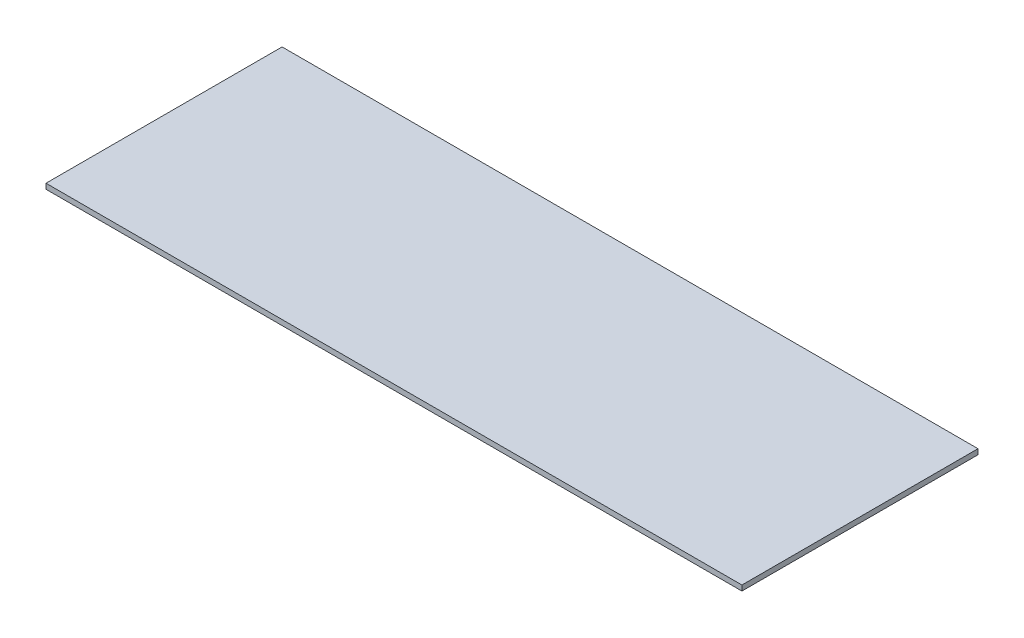
from build123d import *

# Parameters (mm, degrees)
SKETCH1_W           = 395
SKETCH1_H           = 134
BOSS_EXTRUDE1_DEPTH = 3


with BuildPart() as part:
    # Sketch1 → Boss-Extrude1 (new body)
    with BuildSketch(Plane(origin=(0, 0, 0), x_dir=(1, 0, 0), z_dir=(0, 1, 0))):
        with Locations((-67.552219321, -47.477806789)):
            Rectangle(SKETCH1_W, SKETCH1_H)
    extrude(amount=BOSS_EXTRUDE1_DEPTH)


solid = part.part
